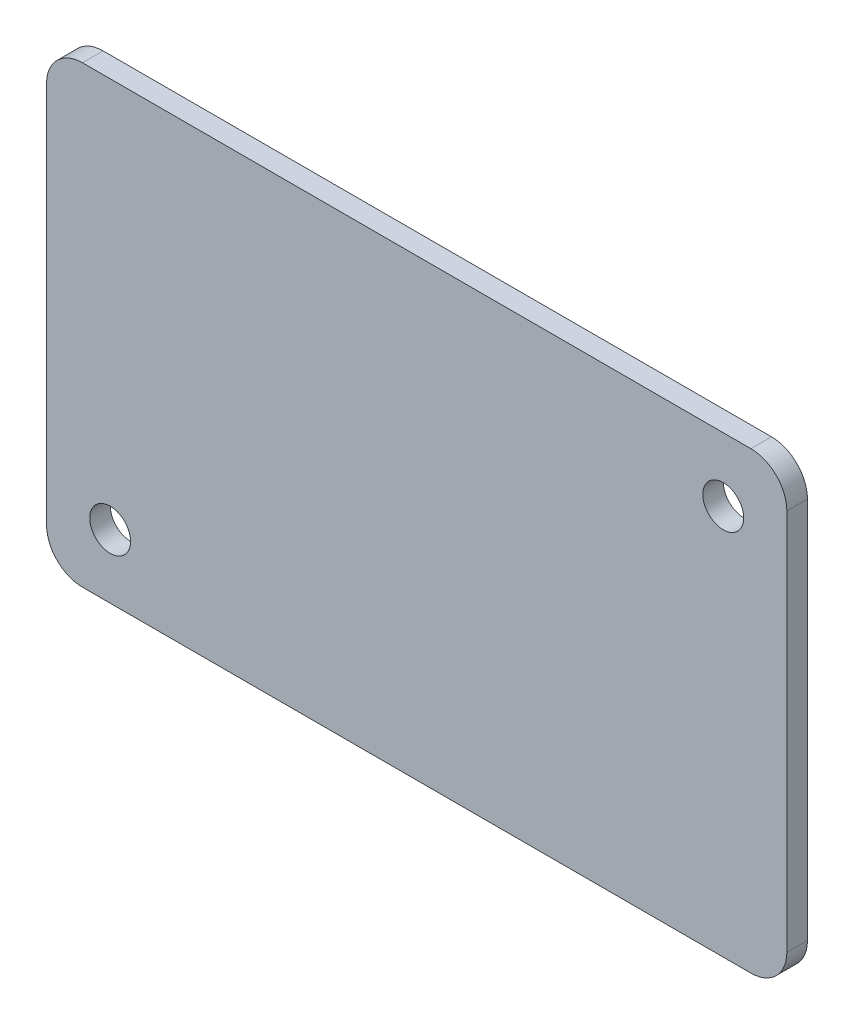
from build123d import *

# Parameters (mm, degrees)
SKETCH1_W           = 57.5056
SKETCH1_H           = 35.2806
SKETCH1_R           = 1.5875
BOSS_EXTRUDE1_DEPTH = 1.6002
FILLET1_R           = 2.794


with BuildPart() as part:
    # Sketch1 → Boss-Extrude1 (new body)
    with BuildSketch(Plane.XY):
        Rectangle(SKETCH1_W, SKETCH1_H)
        with Locations((-23.8125, -12.7)):
            Circle(SKETCH1_R, mode=Mode.SUBTRACT)
        with Locations((23.8125, 12.7)):
            Circle(SKETCH1_R, mode=Mode.SUBTRACT)
    extrude(amount=BOSS_EXTRUDE1_DEPTH)

    # Fillet1
    fillet1_edges = [part.edges().sort_by_distance(p)[0] for p in [
        (-28.7528, 17.6403, 0.8001),
        (28.7528, 17.6403, 0.8001),
        (28.7528, -17.6403, 0.8001),
        (-28.7528, -17.6403, 0.8001),
    ]]
    fillet(fillet1_edges, radius=FILLET1_R)


solid = part.part
